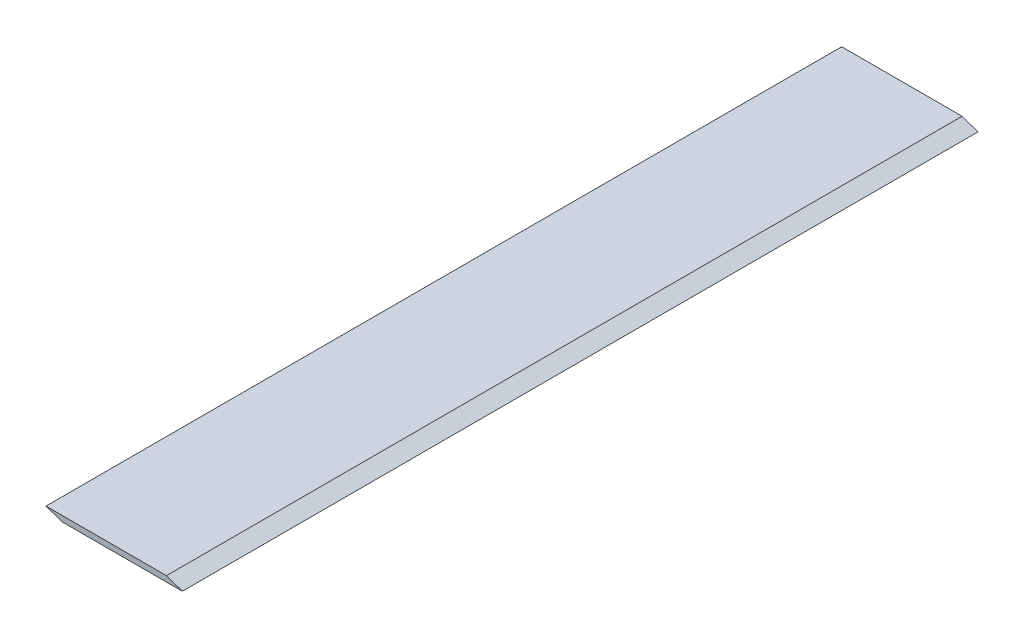
from build123d import *

# Parameters (mm, degrees)
SALIENTE_EXTRUIR1_DEPTH = 195
CROQUIS2_W              = 22.660700849
CROQUIS2_H              = 95
CORTAR_EXTRUIR1_DEPTH   = 0.7
CORTAR_EXTRUIR3_DEPTH   = 100


with BuildPart() as part:
    # Croquis1 → Saliente-Extruir1 (new body)
    with BuildSketch(Plane.XY):
        Polygon((0, 0), (22, 0), (20, 0.7), (0, 0.7), align=None)
    extrude(amount=SALIENTE_EXTRUIR1_DEPTH)

    # Croquis2 → Cortar-Extruir1 (cut)
    with BuildSketch(Plane.XZ):
        with Locations((11.330350425, 47.5)):
            Rectangle(CROQUIS2_W, CROQUIS2_H)
    extrude(amount=-CORTAR_EXTRUIR1_DEPTH, mode=Mode.SUBTRACT)

    # Croquis3 → Cortar-Extruir3 (cut)
    with BuildSketch(Plane(origin=(0, 0, 95), x_dir=(-1, 0, 0), z_dir=(0, 0, -1))):
        Polygon((0, 0), (0, 0.7), (-4.864557071, 0.7), (-6.864557071, 0), align=None)
    extrude(amount=-CORTAR_EXTRUIR3_DEPTH, mode=Mode.SUBTRACT)


solid = part.part
